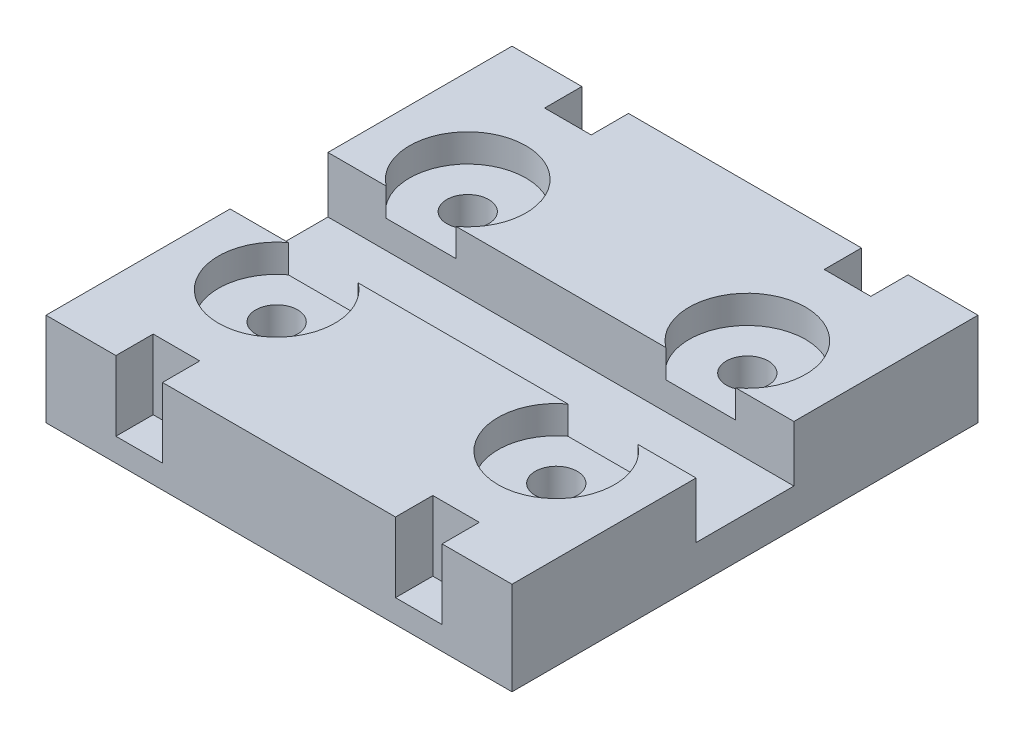
from build123d import *

# Parameters (mm, degrees)
SKETCH2_W           = 100
SKETCH2_H           = 100
BOSS_EXTRUDE1_DEPTH = 20
SKETCH3_W           = 100
SKETCH3_H           = 20
CUT_EXTRUDE1_DEPTH  = 12
SKETCH5_R           = 12.5
CUT_EXTRUDE2_DEPTH  = 6
SKETCH6_R           = 12.5
CUT_EXTRUDE3_DEPTH  = 6
SKETCH7_R           = 12.5
CUT_EXTRUDE4_DEPTH  = 6
SKETCH8_R           = 12.5
CUT_EXTRUDE5_DEPTH  = 6
SKETCH9_R           = 4.5
CUT_EXTRUDE6_DEPTH  = 10
SKETCH10_R          = 4.5
CUT_EXTRUDE7_DEPTH  = 10
SKETCH11_R          = 4.5
CUT_EXTRUDE8_DEPTH  = 10
SKETCH12_R          = 4.5
CUT_EXTRUDE9_DEPTH  = 10
SKETCH13_W          = 10
SKETCH13_H          = 15
CUT_EXTRUDE11_DEPTH = 8
SKETCH15_R          = 2.5
CUT_EXTRUDE13_DEPTH = 16
SKETCH16_W          = 8.1
SKETCH16_H          = 4
CUT_EXTRUDE14_DEPTH = 14
SKETCH17_W          = 10
SKETCH17_H          = 8
CUT_EXTRUDE16_DEPTH = 15
SKETCH19_R          = 2.5
CUT_EXTRUDE17_DEPTH = 16
SKETCH21_W          = 10
SKETCH21_H          = 8
CUT_EXTRUDE19_DEPTH = 15
SKETCH22_W          = 10
SKETCH22_H          = 8
CUT_EXTRUDE20_DEPTH = 15
CUT_EXTRUDE21_START = -16
SKETCH23_R          = 2.5
CUT_EXTRUDE21_DEPTH = 16
CUT_EXTRUDE22_START = -16
SKETCH24_R          = 2.5
CUT_EXTRUDE22_DEPTH = 16
SKETCH25_W          = 8.1
SKETCH25_H          = 4
CUT_EXTRUDE23_DEPTH = 15
SKETCH26_W          = 8.1
SKETCH26_H          = 4
CUT_EXTRUDE24_DEPTH = 15
SKETCH27_W          = 8.1
SKETCH27_H          = 4
CUT_EXTRUDE25_DEPTH = 15
SKETCH28_W          = 100
SKETCH28_H          = 12
CUT_EXTRUDE26_DEPTH = 0.5
SKETCH29_W          = 100
SKETCH29_H          = 12
CUT_EXTRUDE27_DEPTH = 0.5


with BuildPart() as part:
    # Sketch2 → Boss-Extrude1 (new body)
    with BuildSketch(Plane(origin=(0, 0, 0), x_dir=(1, 0, 0), z_dir=(0, 1, 0))):
        with Locations((-37.64268429, -41.588796838)):
            Rectangle(SKETCH2_W, SKETCH2_H)
    extrude(amount=BOSS_EXTRUDE1_DEPTH)

    # Sketch3 → Cut-Extrude1 (cut)
    with BuildSketch(Plane(origin=(0, 20, 0), x_dir=(1, 0, 0), z_dir=(0, 1, 0))):
        with Locations((-37.64268429, -41.588796838)):
            Rectangle(SKETCH3_W, SKETCH3_H)
    extrude(amount=-CUT_EXTRUDE1_DEPTH, mode=Mode.SUBTRACT)

    # Sketch5 → Cut-Extrude2 (cut)
    with BuildSketch(Plane(origin=(0, 20, 0), x_dir=(1, 0, 0), z_dir=(0, 1, 0))):
        with Locations((-7.64268429, -62.088796838)):
            Circle(SKETCH5_R)
    extrude(amount=-CUT_EXTRUDE2_DEPTH, mode=Mode.SUBTRACT)

    # Sketch6 → Cut-Extrude3 (cut)
    with BuildSketch(Plane(origin=(0, 20, 0), x_dir=(1, 0, 0), z_dir=(0, 1, 0))):
        with Locations((-67.64268429, -62.088796838)):
            Circle(SKETCH6_R)
    extrude(amount=-CUT_EXTRUDE3_DEPTH, mode=Mode.SUBTRACT)

    # Sketch7 → Cut-Extrude4 (cut)
    with BuildSketch(Plane(origin=(0, 20, 0), x_dir=(1, 0, 0), z_dir=(0, 1, 0))):
        with Locations((-67.64268429, -21.088796838)):
            Circle(SKETCH7_R)
    extrude(amount=-CUT_EXTRUDE4_DEPTH, mode=Mode.SUBTRACT)

    # Sketch8 → Cut-Extrude5 (cut)
    with BuildSketch(Plane(origin=(0, 20, 0), x_dir=(1, 0, 0), z_dir=(0, 1, 0))):
        with Locations((-7.64268429, -21.088796838)):
            Circle(SKETCH8_R)
    extrude(amount=-CUT_EXTRUDE5_DEPTH, mode=Mode.SUBTRACT)

    # Sketch9 → Cut-Extrude6 (cut)
    with BuildSketch(Plane(origin=(0, 14, 0), x_dir=(1, 0, 0), z_dir=(0, 1, 0))):
        with Locations(Location((-67.64268429, -21.088796838, 0), (0, 0, 270))):
            Circle(SKETCH9_R)
    extrude(amount=-CUT_EXTRUDE6_DEPTH, mode=Mode.SUBTRACT)

    # Sketch10 → Cut-Extrude7 (cut)
    with BuildSketch(Plane(origin=(0, 14, 0), x_dir=(1, 0, 0), z_dir=(0, 1, 0))):
        with Locations(Location((-7.64268429, -21.088796838, 0), (0, 0, 270))):
            Circle(SKETCH10_R)
    extrude(amount=-CUT_EXTRUDE7_DEPTH, mode=Mode.SUBTRACT)

    # Sketch11 → Cut-Extrude8 (cut)
    with BuildSketch(Plane(origin=(0, 14, 0), x_dir=(1, 0, 0), z_dir=(0, 1, 0))):
        with Locations(Location((-7.64268429, -62.088796838, 0), (0, 0, 270))):
            Circle(SKETCH11_R)
    extrude(amount=-CUT_EXTRUDE8_DEPTH, mode=Mode.SUBTRACT)

    # Sketch12 → Cut-Extrude9 (cut)
    with BuildSketch(Plane(origin=(0, 14, 0), x_dir=(1, 0, 0), z_dir=(0, 1, 0))):
        with Locations(Location((-67.64268429, -62.088796838, 0), (0, 0, 270))):
            Circle(SKETCH12_R)
    extrude(amount=-CUT_EXTRUDE9_DEPTH, mode=Mode.SUBTRACT)

    # Sketch13 → Cut-Extrude11 (cut)
    with BuildSketch(Plane.XY.offset(91.588796838)):
        with Locations((-67.64268429, 12.5)):
            Rectangle(SKETCH13_W, SKETCH13_H)
    extrude(amount=-CUT_EXTRUDE11_DEPTH, mode=Mode.SUBTRACT)

    # Sketch15 → Cut-Extrude13 (cut)
    with BuildSketch(Plane.XY.offset(83.588796838)):
        with Locations((-67.64268429, 10)):
            Circle(SKETCH15_R)
    extrude(amount=-CUT_EXTRUDE13_DEPTH, mode=Mode.SUBTRACT)

    # Sketch16 → Cut-Extrude14 (cut)
    with BuildSketch(Plane(origin=(0, 0, 0), x_dir=(-1, 0, 0), z_dir=(0, -1, 0))):
        with Locations((67.64268429, -78.588796838)):
            Rectangle(SKETCH16_W, SKETCH16_H)
    extrude(amount=-CUT_EXTRUDE14_DEPTH, mode=Mode.SUBTRACT)

    # Sketch17 → Cut-Extrude16 (cut)
    with BuildSketch(Plane(origin=(0, 20, 0), x_dir=(1, 0, 0), z_dir=(0, 1, 0))):
        with Locations((-7.64268429, -87.588796838)):
            Rectangle(SKETCH17_W, SKETCH17_H)
    extrude(amount=-CUT_EXTRUDE16_DEPTH, mode=Mode.SUBTRACT)

    # Sketch19 → Cut-Extrude17 (cut)
    with BuildSketch(Plane.XY.offset(83.588796838)):
        with Locations((-7.64268429, 10)):
            Circle(SKETCH19_R)
    extrude(amount=-CUT_EXTRUDE17_DEPTH, mode=Mode.SUBTRACT)

    # Sketch21 → Cut-Extrude19 (cut)
    with BuildSketch(Plane(origin=(0, 20, 0), x_dir=(1, 0, 0), z_dir=(0, 1, 0))):
        with Locations((-67.64268429, 4.411203162)):
            Rectangle(SKETCH21_W, SKETCH21_H)
    extrude(amount=-CUT_EXTRUDE19_DEPTH, mode=Mode.SUBTRACT)

    # Sketch22 → Cut-Extrude20 (cut)
    with BuildSketch(Plane(origin=(0, 20, 0), x_dir=(1, 0, 0), z_dir=(0, 1, 0))):
        with Locations((-7.64268429, 4.411203162)):
            Rectangle(SKETCH22_W, SKETCH22_H)
    extrude(amount=-CUT_EXTRUDE20_DEPTH, mode=Mode.SUBTRACT)

    # Sketch23 → Cut-Extrude21 (cut)
    with BuildSketch(Plane(origin=(0, 0, -0.411203162), x_dir=(-1, 0, 0), z_dir=(0, 0, -1)).offset(CUT_EXTRUDE21_START)):
        with Locations(Location((7.64268429, 10, 0), (0, 0, 180))):
            Circle(SKETCH23_R)
    extrude(amount=CUT_EXTRUDE21_DEPTH, mode=Mode.SUBTRACT)

    # Sketch24 → Cut-Extrude22 (cut)
    with BuildSketch(Plane(origin=(0, 0, -0.411203162), x_dir=(-1, 0, 0), z_dir=(0, 0, -1)).offset(CUT_EXTRUDE22_START)):
        with Locations(Location((67.64268429, 10, 0), (0, 0, 180))):
            Circle(SKETCH24_R)
    extrude(amount=CUT_EXTRUDE22_DEPTH, mode=Mode.SUBTRACT)

    # Sketch25 → Cut-Extrude23 (cut)
    with BuildSketch(Plane(origin=(0, 0, 0), x_dir=(-1, 0, 0), z_dir=(0, -1, 0))):
        with Locations((7.64268429, -78.588796838)):
            Rectangle(SKETCH25_W, SKETCH25_H)
    extrude(amount=-CUT_EXTRUDE23_DEPTH, mode=Mode.SUBTRACT)

    # Sketch26 → Cut-Extrude24 (cut)
    with BuildSketch(Plane(origin=(0, 0, 0), x_dir=(-1, 0, 0), z_dir=(0, -1, 0))):
        with Locations((7.64268429, -4.588796838)):
            Rectangle(SKETCH26_W, SKETCH26_H)
    extrude(amount=-CUT_EXTRUDE24_DEPTH, mode=Mode.SUBTRACT)

    # Sketch27 → Cut-Extrude25 (cut)
    with BuildSketch(Plane(origin=(0, 0, 0), x_dir=(-1, 0, 0), z_dir=(0, -1, 0))):
        with Locations((67.64268429, -4.588796838)):
            Rectangle(SKETCH27_W, SKETCH27_H)
    extrude(amount=-CUT_EXTRUDE25_DEPTH, mode=Mode.SUBTRACT)

    # Sketch28 → Cut-Extrude26 (cut)
    with BuildSketch(Plane.XY.offset(31.588796838)):
        with Locations((-37.64268429, 14)):
            Rectangle(SKETCH28_W, SKETCH28_H)
    extrude(amount=-CUT_EXTRUDE26_DEPTH, mode=Mode.SUBTRACT)

    # Sketch29 → Cut-Extrude27 (cut)
    with BuildSketch(Plane(origin=(0, 0, 51.588796838), x_dir=(-1, 0, 0), z_dir=(0, 0, -1))):
        with Locations((37.64268429, 14)):
            Rectangle(SKETCH29_W, SKETCH29_H)
    extrude(amount=-CUT_EXTRUDE27_DEPTH, mode=Mode.SUBTRACT)


solid = part.part
